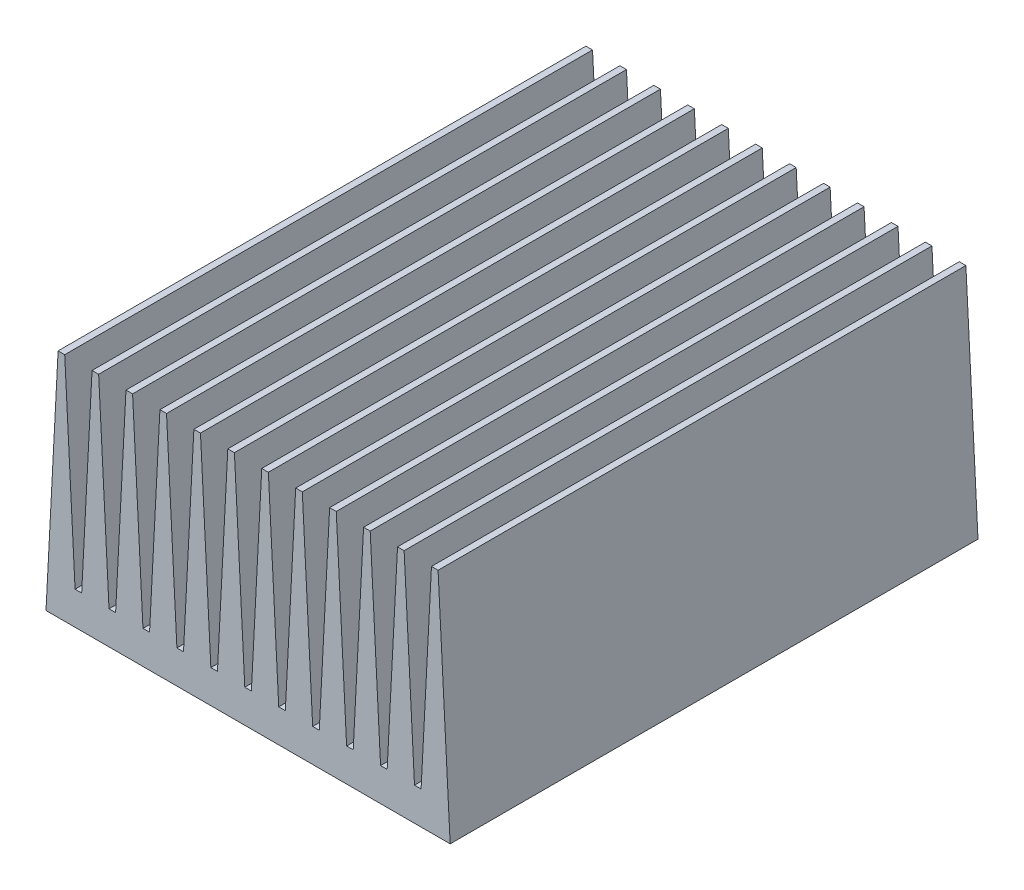
from build123d import *

# Parameters (mm, degrees)
BOSS_EXTRUDE1_DEPTH = 80


with BuildPart() as part:
    # Sketch1 → Boss-Extrude1 (new body)
    with BuildSketch(Plane.XY):
        Polygon((0.262038896, -5), (0, 0), (-4.144466757, 0), (-5.144466757, 0), (-9.288933514, 0), (-10.288933514, 0), (-14.433400271, 0), (-15.433400271, 0), (-19.577867028, 0), (-20.577867028, 0), (-24.722333785, 0), (-25.722333785, 0), (-29.866800542, 0), (-30.866800542, 0), (-35.011267299, 0), (-36.011267299, 0), (-40.155734056, 0), (-41.155734056, 0), (-45.300200813, 0), (-46.300200813, 0), (-50.44466757, 0), (-51.44466757, 0), (-55.589134327, 0), (-56.589134327, 0), (-60.733601084, 0), (-60.99563998, -5), align=None)
        Polygon((-54.016900948, 30), (-55.589134327, 0), (-51.44466757, 0), (-53.016900948, 30), align=None)
        Polygon((-59.161367705, 30), (-60.733601084, 0), (-56.589134327, 0), (-58.161367705, 30), align=None)
        Polygon((-48.872434191, 30), (-50.44466757, 0), (-46.300200813, 0), (-47.872434191, 30), align=None)
        Polygon((-43.727967434, 30), (-45.300200813, 0), (-41.155734056, 0), (-42.727967434, 30), align=None)
        Polygon((-38.583500677, 30), (-40.155734056, 0), (-36.011267299, 0), (-37.583500677, 30), align=None)
        Polygon((-35.011267299, 0), (-30.866800542, 0), (-32.43903392, 30), (-33.43903392, 30), align=None)
        Polygon((-29.866800542, 0), (-25.722333785, 0), (-27.294567163, 30), (-28.294567163, 30), align=None)
        Polygon((-24.722333785, 0), (-20.577867028, 0), (-22.150100406, 30), (-23.150100406, 30), align=None)
        Polygon((-19.577867028, 0), (-15.433400271, 0), (-17.005633649, 30), (-18.005633649, 30), align=None)
        Polygon((-14.433400271, 0), (-10.288933514, 0), (-11.861166892, 30), (-12.861166892, 30), align=None)
        Polygon((-9.288933514, 0), (-5.144466757, 0), (-6.716700135, 30), (-7.716700135, 30), align=None)
        Polygon((-4.144466757, 0), (0, 0), (-1.572233378, 30), (-2.572233378, 30), align=None)
    extrude(amount=BOSS_EXTRUDE1_DEPTH)


solid = part.part
